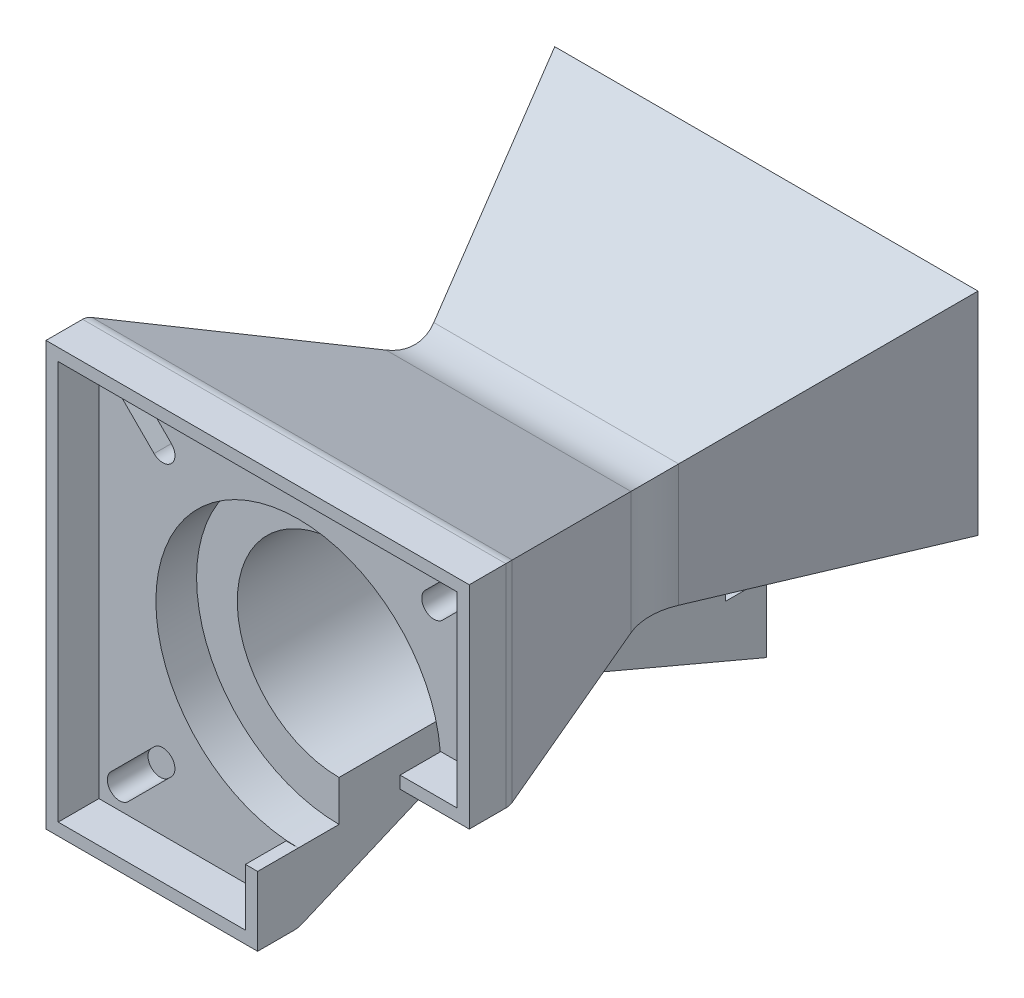
from build123d import *

# Parameters (mm, degrees)
SKETCH1_W           = 104
SKETCH1_H           = 104
BOSS_EXTRUDE1_DEPTH = 57.5
BOSS_EXTRUDE1_TAPER = 23
SKETCH2_R           = 25
CUT_EXTRUDE1_DEPTH  = 137.502747225
SKETCH3_R           = 35
CUT_EXTRUDE2_DEPTH  = 10
CUT_EXTRUDE3_START  = -10
SKETCH4_R           = 35
CUT_EXTRUDE3_DEPTH  = 10
FILLET1_R           = 15
SKETCH6_W           = 52
SKETCH6_H           = 52
CUT_EXTRUDE4_DEPTH  = 137.502747225
BOSS_EXTRUDE2_DEPTH = 10
CUT_EXTRUDE5_DEPTH  = 10
FILLET2_R           = 5


with BuildPart() as part:
    # Sketch1 → Boss-Extrude1 (new body)
    with BuildSketch(Plane.XY):
        Rectangle(SKETCH1_W, SKETCH1_H)
    extrude(amount=BOSS_EXTRUDE1_DEPTH, taper=BOSS_EXTRUDE1_TAPER)

    # Mirror13: part across plane


with BuildPart() as part_1:
    add(part.part)
    add(part.part.mirror(Plane(origin=(0, 0, 57.5), x_dir=(1, 0, 0), z_dir=(0, 0, -1))))

    # Sketch2 → Cut-Extrude1 (cut, through all)
    with BuildSketch(Plane.XY.offset(115)):
        Circle(SKETCH2_R)
    extrude(amount=-CUT_EXTRUDE1_DEPTH, mode=Mode.SUBTRACT)

    # Sketch3 → Cut-Extrude2 (cut)
    with BuildSketch(Plane.XY.offset(115)):
        Circle(SKETCH3_R)
    extrude(amount=-CUT_EXTRUDE2_DEPTH, mode=Mode.SUBTRACT)

    # Sketch4 → Cut-Extrude3 (cut)
    with BuildSketch(Plane(origin=(0, 0, 0), x_dir=(-1, 0, 0), z_dir=(0, 0, -1)).offset(CUT_EXTRUDE3_START)):
        with Locations(Location((0, 0, 0), (0, 0, 180))):
            Circle(SKETCH4_R)
    extrude(amount=CUT_EXTRUDE3_DEPTH, mode=Mode.SUBTRACT)

    # Fillet1
    fillet1_edges = [part_1.edges().sort_by_distance(p)[0] for p in [
        (27.592698068, 0, 57.5),
        (0, 27.592698068, 57.5),
        (-27.592698068, 0, 57.5),
        (0, -27.592698068, 57.5),
    ]]
    fillet(fillet1_edges, radius=FILLET1_R)

    # Sketch6 → Cut-Extrude4 (cut, through all)
    with BuildSketch(Plane.XY.offset(115)):
        with Locations((26, -26)):
            Rectangle(SKETCH6_W, SKETCH6_H)
    extrude(amount=-CUT_EXTRUDE4_DEPTH, mode=Mode.SUBTRACT)

    # Sketch7 → Boss-Extrude2 (add)
    with BuildSketch(Plane.XY.offset(115)):
        Polygon((49, 49), (49, 3), (35, 3), (35, 0), (52, 0), (52, 52), (-52, 52), (-52, -52), (0, -52), (0, -35), (-3, -35), (-3, -49), (-49, -49), (-49, 49), align=None)
    extrude(amount=BOSS_EXTRUDE2_DEPTH)

    # Sketch8 → Cut-Extrude5 (cut)
    with BuildSketch(Plane.XY.offset(115)):
        with BuildLine():
            Line((-41.805559998, 46.048200685), (-31.19895828, 35.441598967))
            ThreePointArc((-31.19895828, 35.441598967), (-31.19895828, 31.19895828), (-35.441598967, 31.19895828))
            Line((-35.441598967, 31.19895828), (-46.048200685, 41.805559998))
            ThreePointArc((-46.048200685, 41.805559998), (-46.048200685, 46.048200685), (-41.805559998, 46.048200685))
        make_face()
        with BuildLine():
            Line((46.048200685, 41.805559998), (35.441598967, 31.19895828))
            ThreePointArc((35.441598967, 31.19895828), (31.19895828, 31.19895828), (31.19895828, 35.441598967))
            Line((31.19895828, 35.441598967), (41.805559998, 46.048200685))
            ThreePointArc((41.805559998, 46.048200685), (46.048200685, 46.048200685), (46.048200685, 41.805559998))
        make_face()
        with BuildLine():
            Line((-46.048200685, -41.805559998), (-35.441598967, -31.19895828))
            ThreePointArc((-35.441598967, -31.19895828), (-31.19895828, -31.19895828), (-31.19895828, -35.441598967))
            Line((-31.19895828, -35.441598967), (-41.805559998, -46.048200685))
            ThreePointArc((-41.805559998, -46.048200685), (-46.048200685, -46.048200685), (-46.048200685, -41.805559998))
        make_face()
    extrude(amount=-CUT_EXTRUDE5_DEPTH, mode=Mode.SUBTRACT)

    # Fillet2
    fillet2_edges = [part_1.edges().sort_by_distance(p)[0] for p in [
        (0, 52, 115),
        (-52, 0, 115),
        (-26, -52, 115),
        (52, 26, 115),
    ]]
    fillet(fillet2_edges, radius=FILLET2_R)


solid = part_1.part
